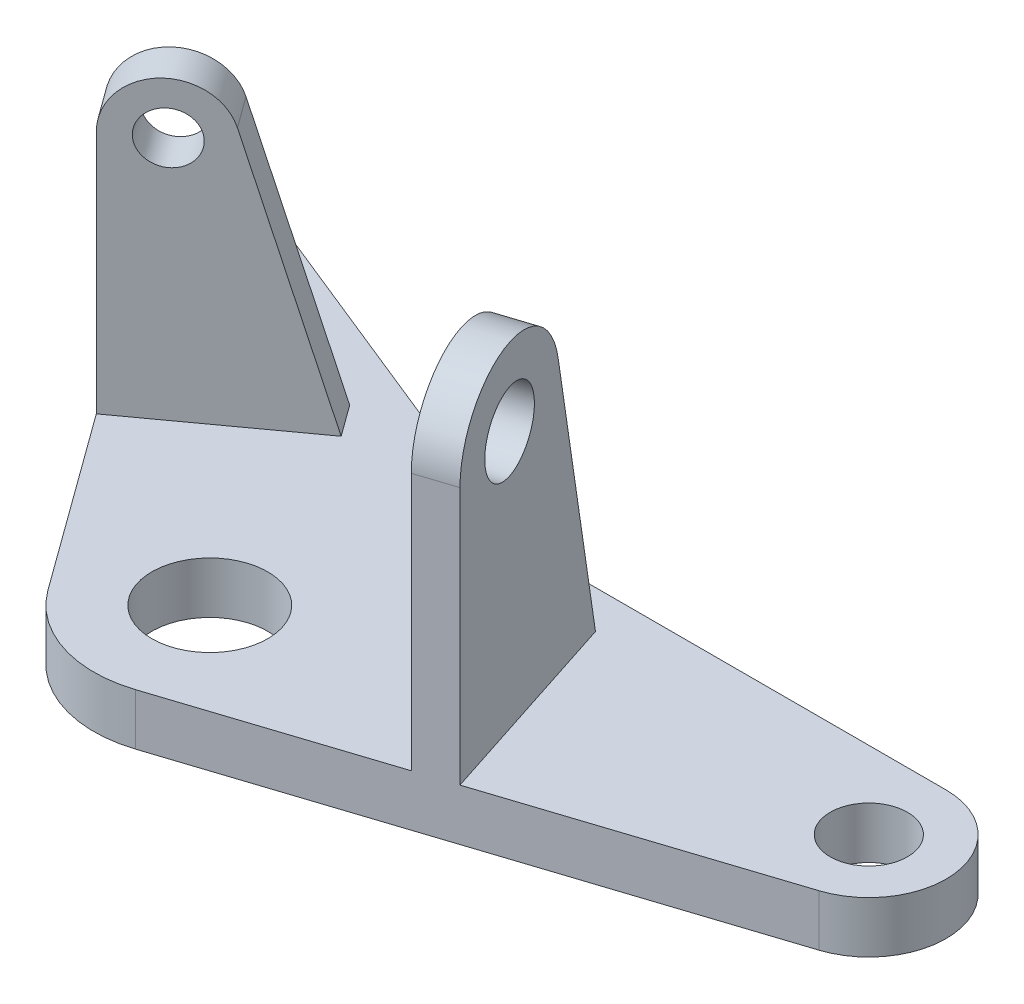
from build123d import *

# Parameters (mm, degrees)
SKETCH1_R           = 9
SKETCH1_R_2         = 4
SKETCH1_R_3         = 6
BOSS_EXTRUDE1_DEPTH = 8
SKETCH2_R           = 4
BOSS_EXTRUDE2_DEPTH = 6
SKETCH3_R           = 6
BOSS_EXTRUDE3_DEPTH = 6


with BuildPart() as part:
    # Sketch1 → Boss-Extrude1 (new body)
    with BuildSketch(Plane(origin=(0, 0, 0), x_dir=(1, 0, 0), z_dir=(0, 1, 0))):
        with BuildLine():
            Line((-14.562305899, -10.580134541), (-54.472135955, 44.351033997))
            ThreePointArc((-54.472135955, 44.351033997), (-54.304086029, 53.978607818), (-45.003147253, 56.470786852))
            Line((-45.003147253, 56.470786852), (7.166404253, 35.392919854))
            ThreePointArc((7.166404253, 35.392919854), (14.88590337, 33.106300041), (22.899881176, 32.334641746))
            Line((22.899881176, 32.334641746), (82, 32.334641746))
            ThreePointArc((82, 32.334641746), (93.852260087, 22.211855326), (85.708203932, 8.92196355))
            Line((85.708203932, 8.92196355), (5.562305899, -17.119017293))
            ThreePointArc((5.562305899, -17.119017293), (-5.562305899, -17.119017293), (-14.562305899, -10.580134541))
        make_face()
        with Locations(Location((0, 0, 0), (0, 0, 270))):
            Circle(SKETCH1_R, mode=Mode.SUBTRACT)
        with Locations(Location((-48, 49.053316016, 0), (0, 0, 270))):
            Circle(SKETCH1_R_2, mode=Mode.SUBTRACT)
        with Locations(Location((82, 20.334641746, 0), (0, 0, 270))):
            Circle(SKETCH1_R_3, mode=Mode.SUBTRACT)
    extrude(amount=BOSS_EXTRUDE1_DEPTH)

    # Sketch2 → Boss-Extrude2 (add)
    with BuildSketch(Plane(origin=(-19.984698578, 0, -27.506577809), x_dir=(0.8090169943749441, 0, -0.5877852522924778), z_dir=(0.5877852522924778, 0, 0.8090169943749441))):
        with BuildLine():
            Line((-18, 0), (-18, 46))
            ThreePointArc((-18, 46), (-11.113384808, 53.92214455), (-2.309906432, 48.205098847))
            Line((-2.309906432, 48.205098847), (11.512683232, 0))
            Line((11.512683232, 0), (-18, 0))
        make_face()
        with Locations((-10, 46)):
            Circle(SKETCH2_R, mode=Mode.SUBTRACT)
    extrude(amount=-BOSS_EXTRUDE2_DEPTH)

    # Sketch3 → Boss-Extrude3 (add)
    with BuildSketch(Plane(origin=(32.335921554, 0, -10.506577809), x_dir=(0.3090169943749411, 0, 0.9510565162951556), z_dir=(-0.9510565162951556, 0, 0.3090169943749411))):
        with BuildLine():
            Line((18, 0), (18, 48))
            ThreePointArc((18, 48), (7.254341559, 59.934262744), (-5.737771209, 50.49494029))
            Line((-5.737771209, 50.49494029), (-16.470802099, 0))
            Line((-16.470802099, 0), (18, 0))
        make_face()
        with Locations((6, 48)):
            Circle(SKETCH3_R, mode=Mode.SUBTRACT)
    extrude(amount=-BOSS_EXTRUDE3_DEPTH)


solid = part.part
